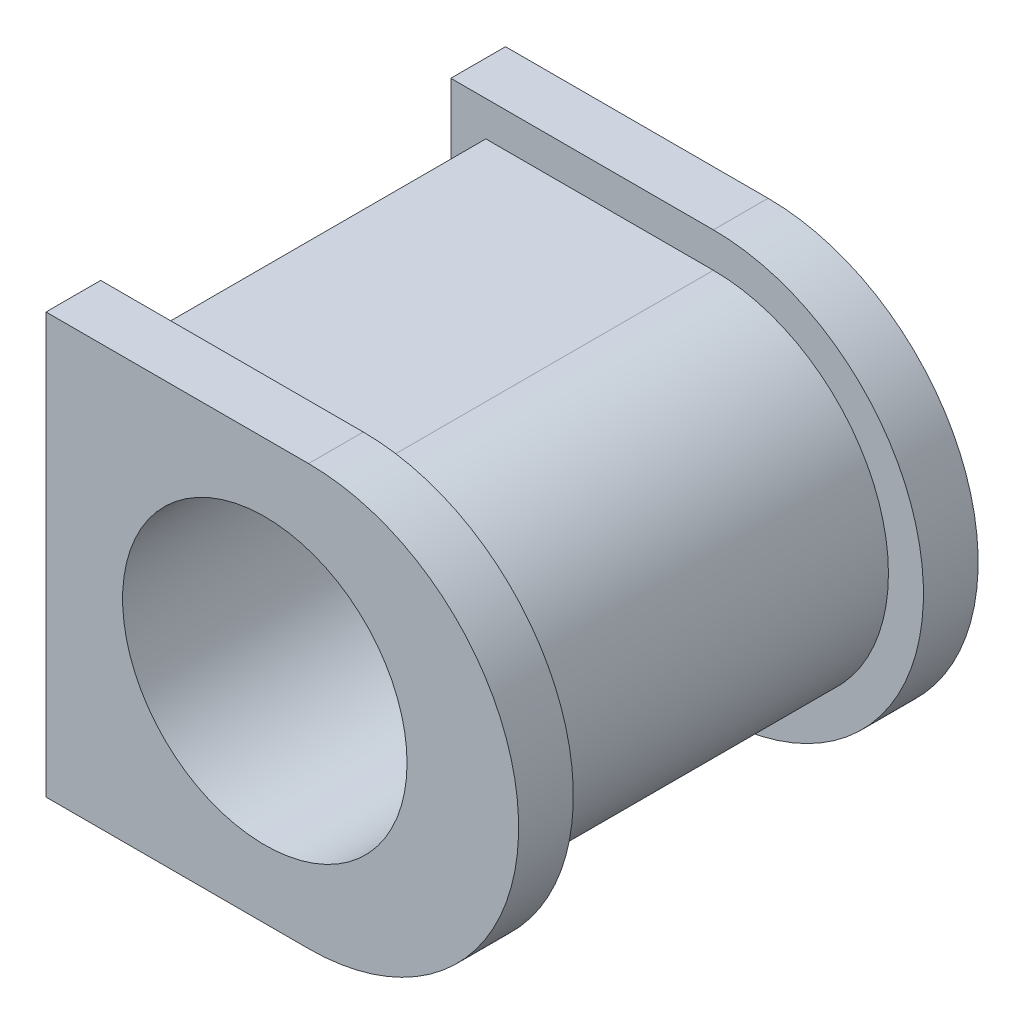
from build123d import *

# Parameters (mm, degrees)
BOSS_EXTRUDE1_DEPTH   = 80
BOSS_EXTRUDE2_DEPTH   = 12.5
F_1_0MM_DOWEL_HOLE1_D = 65


with BuildPart() as part:
    # Sketch1 → Boss-Extrude1 (new body)
    with BuildSketch(Plane.XY):
        with BuildLine():
            Line((0, -40), (0, 40))
            Line((0, 40), (52, 40))
            ThreePointArc((52, 40), (92, 0), (52, -40))
            Line((52, -40), (0, -40))
        make_face()
    extrude(amount=BOSS_EXTRUDE1_DEPTH)

    # Sketch2 → Boss-Extrude2 (add)
    with BuildSketch(Plane.XY.offset(80)):
        with BuildLine():
            Line((-8, 48), (-8, -48))
            Line((-8, -48), (52, -48))
            ThreePointArc((52, -48), (100, 0), (52, 48))
            Line((52, 48), (-8, 48))
        make_face()
    extrude(amount=BOSS_EXTRUDE2_DEPTH)

    # Mirror1: part across plane


with BuildPart() as part_1:
    add(part.part)
    add(part.part.mirror(Plane(origin=(0, 0, 40), x_dir=(1, 0, 0), z_dir=(0, 0, -1))))

    # Ø1.0mm Dowel Hole1 (through all)
    with Locations(Plane(origin=(42, 0, 92.5), x_dir=(1, 0, 0), z_dir=(0, 0, 1))):
        with Locations((0, 0)):
            Hole(F_1_0MM_DOWEL_HOLE1_D / 2)


solid = part_1.part
